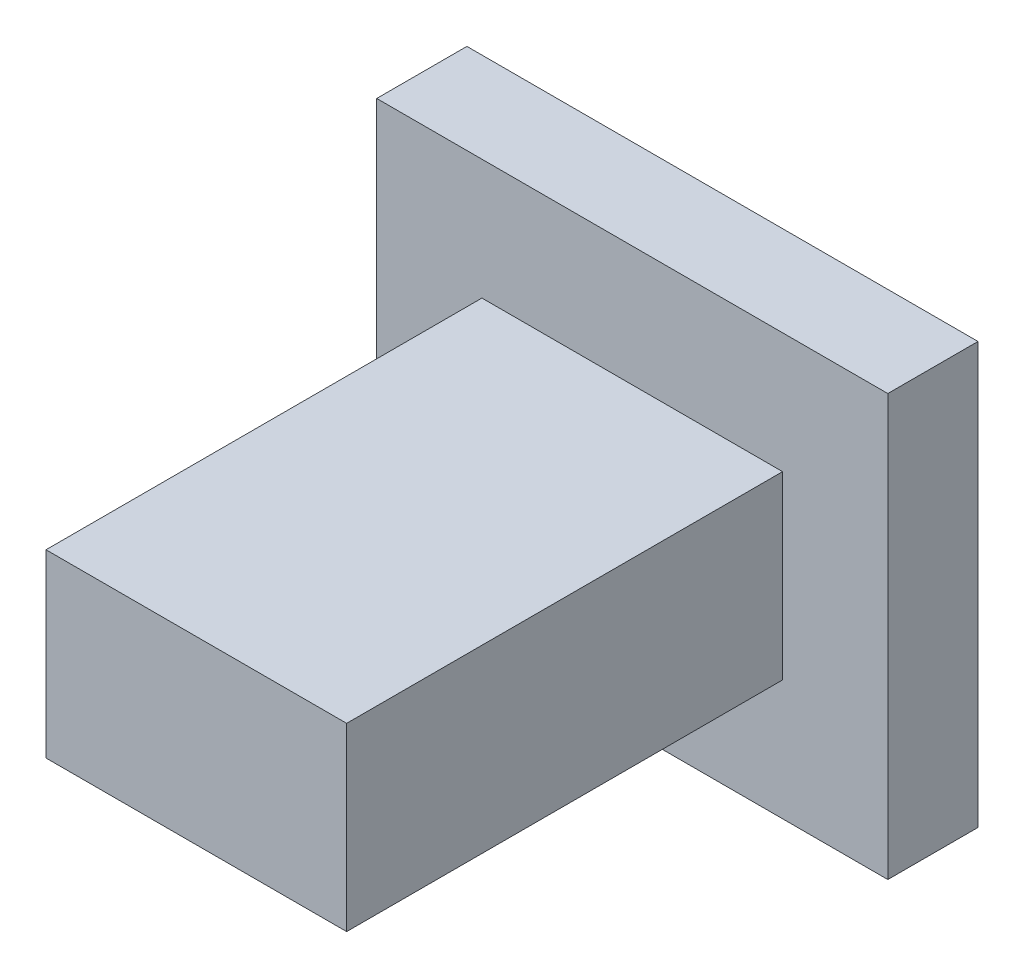
from build123d import *

# Parameters (mm, degrees)
SKETCH1_W           = 8.5
SKETCH1_H           = 7
BOSS_EXTRUDE1_DEPTH = 1.5
BOSS_EXTRUDE2_DEPTH = 2.25
SKETCH3_W           = 5
SKETCH3_H           = 3
BOSS_EXTRUDE3_DEPTH = 6.5


with BuildPart() as part:
    # Sketch1 → Boss-Extrude1 (new body)
    with BuildSketch(Plane.XY):
        with Locations((2.5, 1.5)):
            Rectangle(SKETCH1_W, SKETCH1_H)
        Polygon((5, 0), (0, 0), (0, 0.825), (0, 2.175), (0, 3), (5, 3), align=None, mode=Mode.SUBTRACT)
    extrude(amount=BOSS_EXTRUDE1_DEPTH)

    # Sketch1<3> → Boss-Extrude2 (add)
    with BuildSketch(Plane.XY):
        Polygon((0, 0.825), (0, 0), (5, 0), (5, 3), (0, 3), (0, 2.175), (1.35, 2.175), (1.35, 0.825), align=None)
    extrude(amount=BOSS_EXTRUDE2_DEPTH)

    # Sketch3 → Boss-Extrude3 (add)
    with BuildSketch(Plane.XY.offset(2.25)):
        with Locations((2.5, 1.5)):
            Rectangle(SKETCH3_W, SKETCH3_H)
    extrude(amount=BOSS_EXTRUDE3_DEPTH)


solid = part.part
